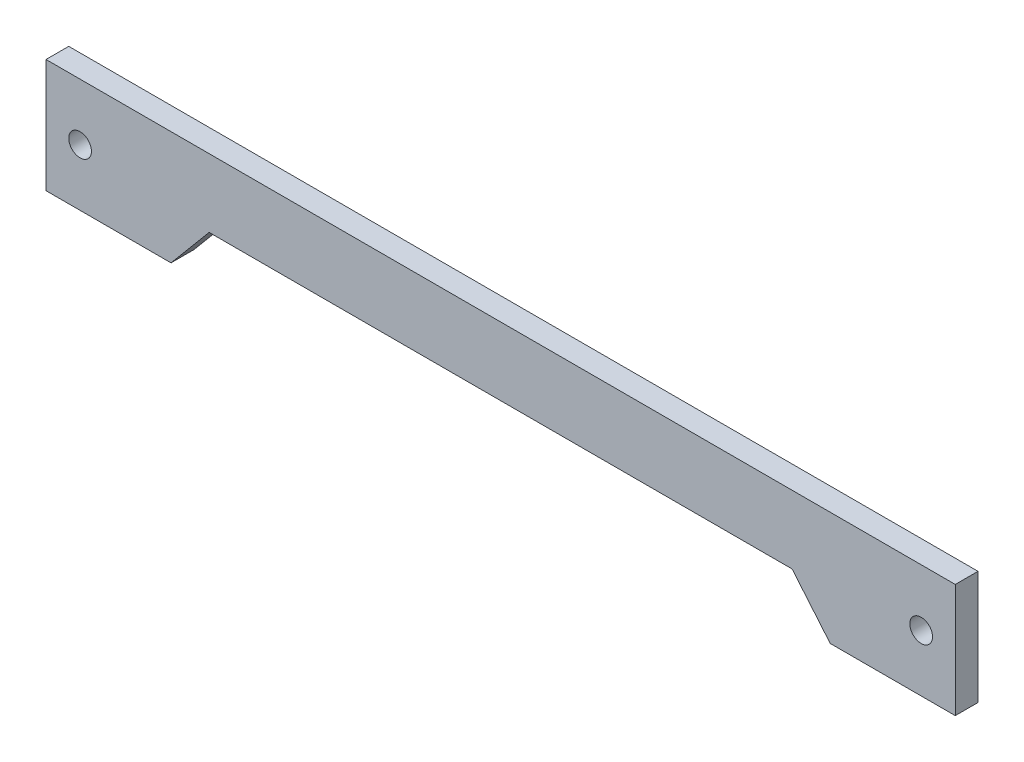
from build123d import *

# Parameters (mm, degrees)
GRUNDPLATTE_DEPTH               = 4
SKIZZE2_R                       = 2
SCHNITT_LINEAR_AUSTRAGEN1_DEPTH = 83.559069762


with BuildPart() as part:
    # Skizze1 → Grundplatte (new body)
    with BuildSketch(Plane.XY):
        Polygon((80, 0), (-80, 0), (-80, -20), (-58, -20), (-51.287202951, -12), (51.287202951, -12), (58, -20), (80, -20), align=None)
    extrude(amount=GRUNDPLATTE_DEPTH)

    # Skizze2 → Schnitt-Linear austragen1 (cut, through all)
    with BuildSketch(Plane.XY.offset(4)):
        with Locations((-74, -10)):
            Circle(SKIZZE2_R)
        with Locations(Location((74, -10, 0), (0, 0, 180))):
            Circle(SKIZZE2_R)
    extrude(amount=-SCHNITT_LINEAR_AUSTRAGEN1_DEPTH, mode=Mode.SUBTRACT)


solid = part.part
